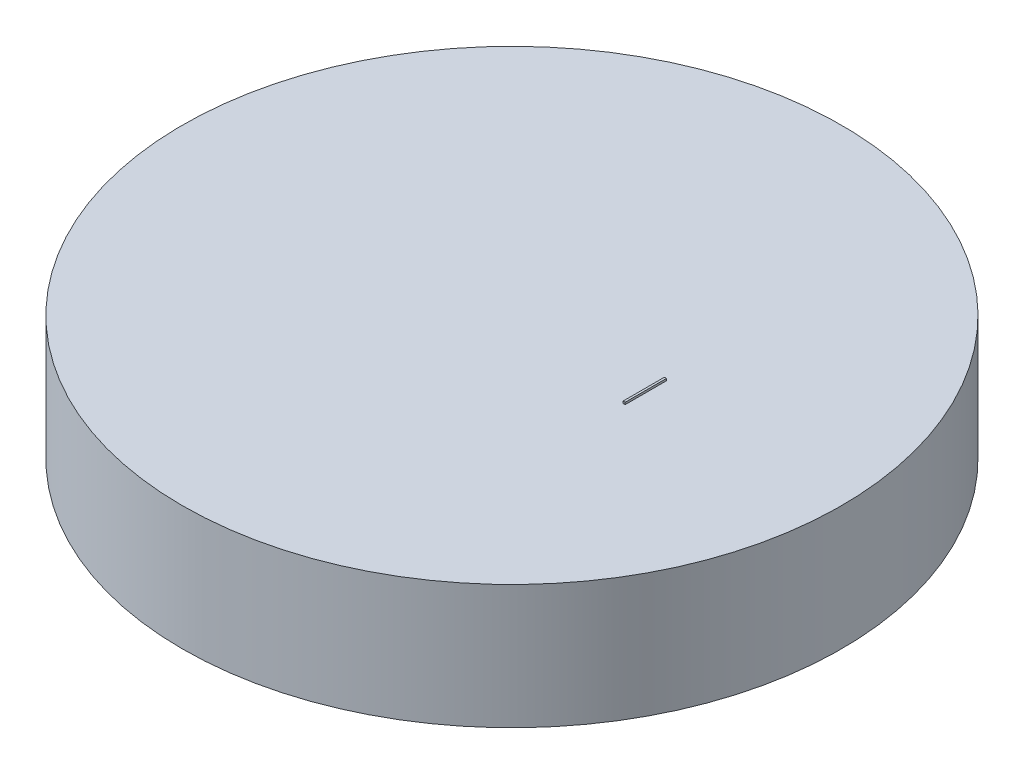
from build123d import *

# Parameters (mm, degrees)
SKETCH1_R           = 159.375
BOSS_EXTRUDE2_DEPTH = 60
BOSS_EXTRUDE4_DEPTH = 1


with BuildPart() as part:
    # Sketch1 → Boss-Extrude2 (new body)
    with BuildSketch(Plane(origin=(0, 0, 0), x_dir=(1, 0, 0), z_dir=(0, 1, 0))):
        with Locations(Location((0, 0, 0), (0, 0, 270))):
            Circle(SKETCH1_R)
    extrude(amount=BOSS_EXTRUDE2_DEPTH)

    # Sketch3 → Boss-Extrude4 (add)
    with BuildSketch(Plane(origin=(0, 60, 0), x_dir=(1, 0, 0), z_dir=(0, 1, 0))):
        Polygon((63.75, 9.990395), (63.75, 0), (63.75, -9.990395), (64.75, -9.990395), (64.75, 9.990395), align=None)
    extrude(amount=BOSS_EXTRUDE4_DEPTH)


solid = part.part
